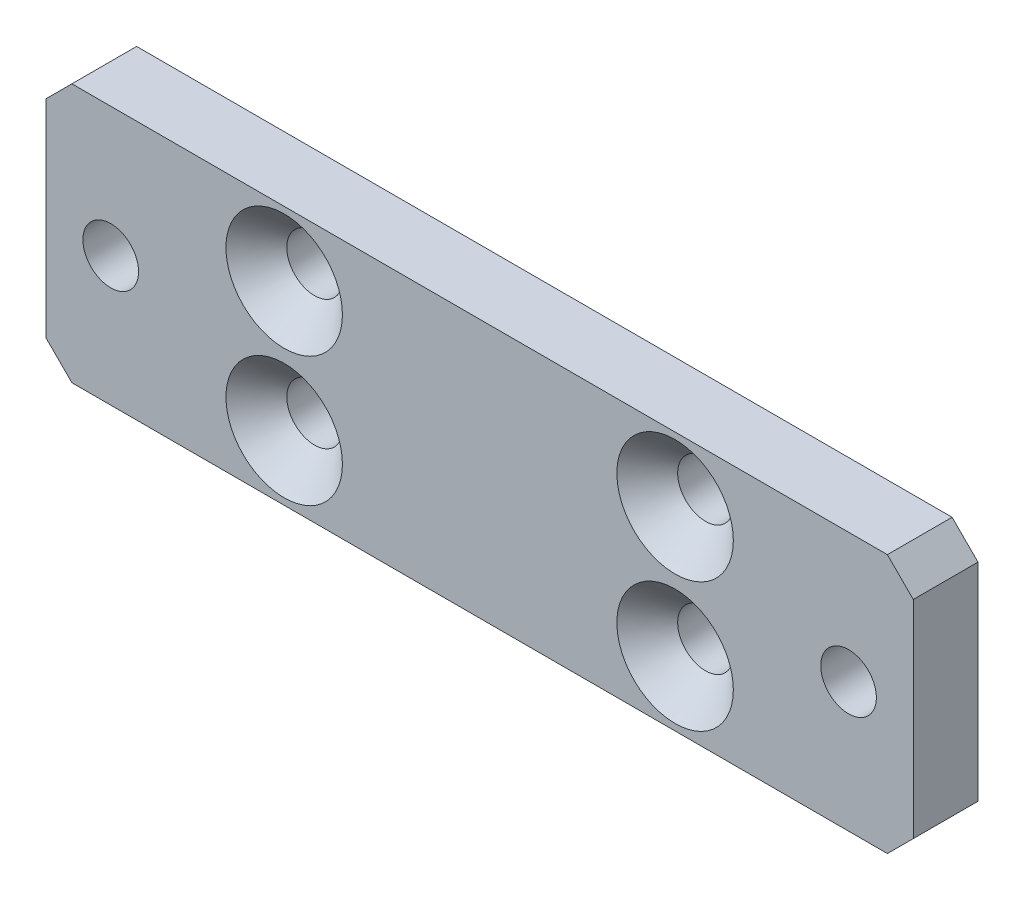
from build123d import *

# Parameters (mm, degrees)
SKETCH1_W                                            = 67
SKETCH1_H                                            = 20
BOSS_EXTRUDE1_DEPTH                                  = 2.5
M4_CLEARANCE_HOLE1_D                                 = 4.3
CSK_FOR_M4_HEX_SOCKET_COUNTERSUNK_CAP_SC_D           = 4.3
CSK_FOR_M4_HEX_SOCKET_COUNTERSUNK_CAP_SC_CSINK_D     = 9
CSK_FOR_M4_HEX_SOCKET_COUNTERSUNK_CAP_SC_CSINK_ANGLE = 90
CHAMFER1_SIZE                                        = 2


with BuildPart() as part:
    # Sketch1 → Boss-Extrude1 (new, symmetric)
    with BuildSketch(Plane.XY):
        Rectangle(SKETCH1_W, SKETCH1_H)
    extrude(amount=BOSS_EXTRUDE1_DEPTH, both=True)

    # M4 Clearance Hole1 (through all)
    with Locations(Plane.XY.offset(2.5)):
        with Locations((-28.5, 0), (28.5, 0)):
            Hole(M4_CLEARANCE_HOLE1_D / 2)

    # CSK for M4 Hex Socket Countersunk Cap Screw1 (through all)
    with Locations(Plane.XY.offset(2.5)):
        with Locations((-15.1, -5), (-15.1, 5), (15.1, 5), (15.1, -5)):
            CounterSinkHole(CSK_FOR_M4_HEX_SOCKET_COUNTERSUNK_CAP_SC_D / 2, CSK_FOR_M4_HEX_SOCKET_COUNTERSUNK_CAP_SC_CSINK_D / 2, counter_sink_angle=CSK_FOR_M4_HEX_SOCKET_COUNTERSUNK_CAP_SC_CSINK_ANGLE)

    # Chamfer1
    chamfer1_edges = [part.edges().sort_by_distance(p)[0] for p in [
        (-33.5, 10, 0),
        (33.5, 10, 0),
        (33.5, -10, 0),
        (-33.5, -10, 0),
    ]]
    chamfer(chamfer1_edges, length=CHAMFER1_SIZE)


solid = part.part
